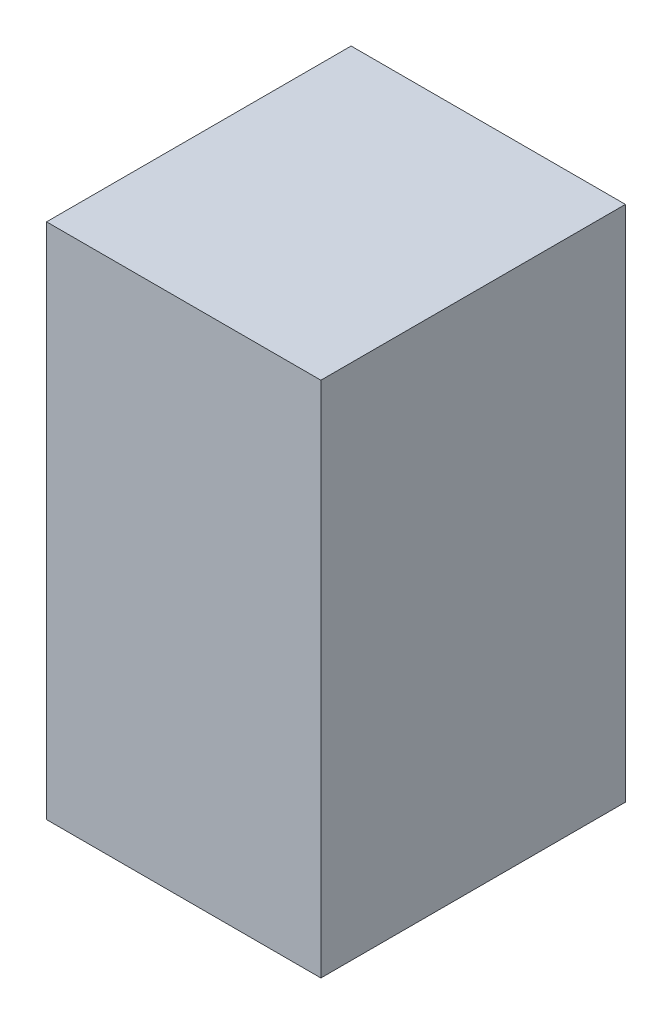
from build123d import *

# Parameters (mm, degrees)
SKETCH1_W               = 0.9008
SKETCH1_H               = 1.7
COMPONENT_OUTLINE_DEPTH = 1


with BuildPart() as part:
    # Sketch1 → Component_Outline (new body)
    with BuildSketch(Plane.XY):
        with Locations((-0.0004, 0)):
            Rectangle(SKETCH1_W, SKETCH1_H)
    extrude(amount=COMPONENT_OUTLINE_DEPTH)


solid = part.part
